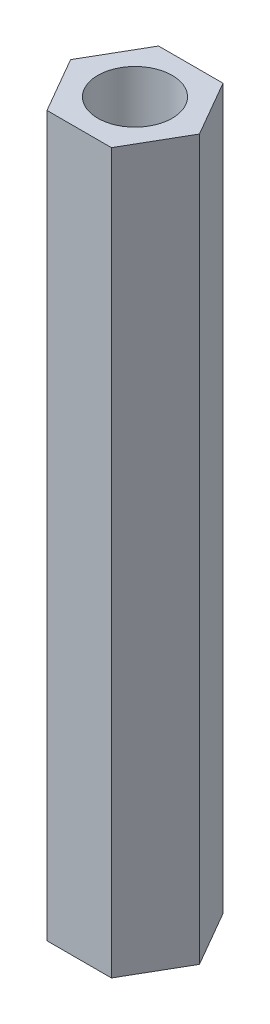
from build123d import *

# Parameters (mm, degrees)
SKETCH_1_R      = 3
EXTRUDE_1_DEPTH = 58


with BuildPart() as part:
    # 草图1 → 凸台-拉伸1 (new body)
    with BuildSketch(Plane(origin=(0, 0, 0), x_dir=(1, 0, 0), z_dir=(0, 1, 0))):
        Polygon((5.196152423, 0), (2.598076211, 4.5), (-2.598076211, 4.5), (-5.196152423, 0), (-2.598076211, -4.5), (2.598076211, -4.5), align=None)
        with Locations(Location((0, 0, 0), (0, 0, 90))):
            Circle(SKETCH_1_R, mode=Mode.SUBTRACT)
    extrude(amount=EXTRUDE_1_DEPTH)


solid = part.part
